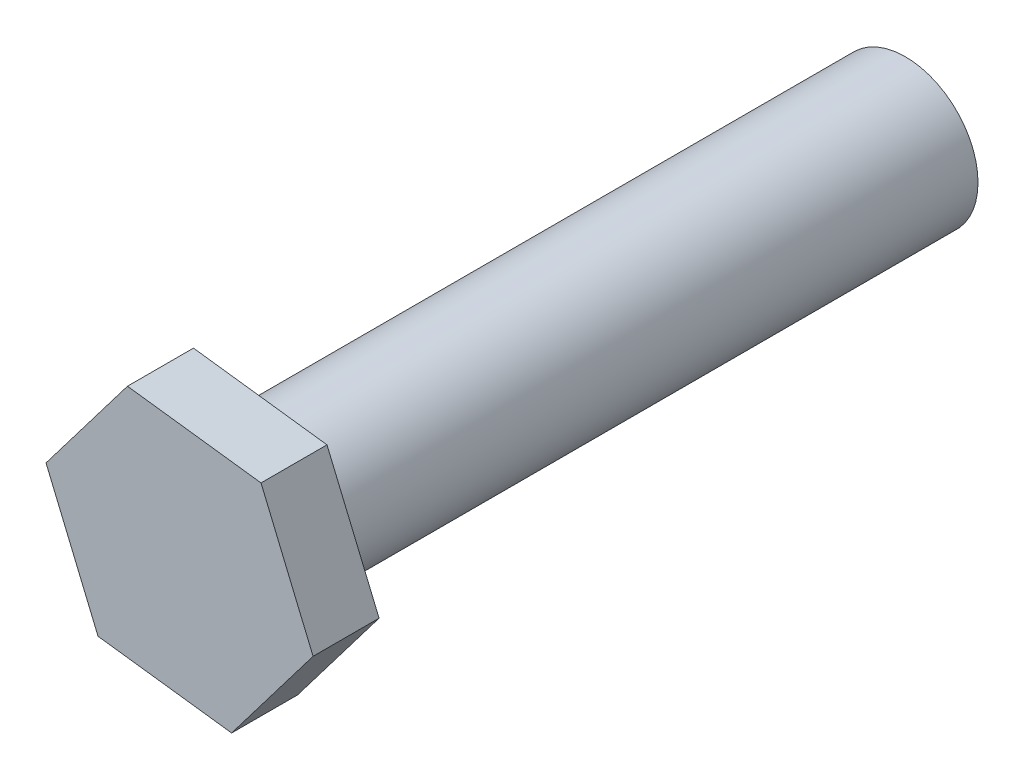
from build123d import *

# Parameters (mm, degrees)
SKETCH_1_R      = 1.65
EXTRUDE_1_DEPTH = 15
EXTRUDE_2_DEPTH = 1.5


with BuildPart() as part:
    # 스케치1 → 보스-돌출1 (new body)
    with BuildSketch(Plane.XY):
        Circle(SKETCH_1_R)
    extrude(amount=EXTRUDE_1_DEPTH)

    # 스케치2 → 보스-돌출2 (add)
    with BuildSketch(Plane(origin=(0, 0, 15), x_dir=(-1, 0, 0), z_dir=(0, 0, -1))):
        Polygon((1.852010162, -2.435855433), (3.035517766, 0.385960132), (1.183507604, 2.821815565), (-1.852010162, 2.435855433), (-3.035517766, -0.385960132), (-1.183507604, -2.821815565), align=None)
    extrude(amount=-EXTRUDE_2_DEPTH)


solid = part.part
